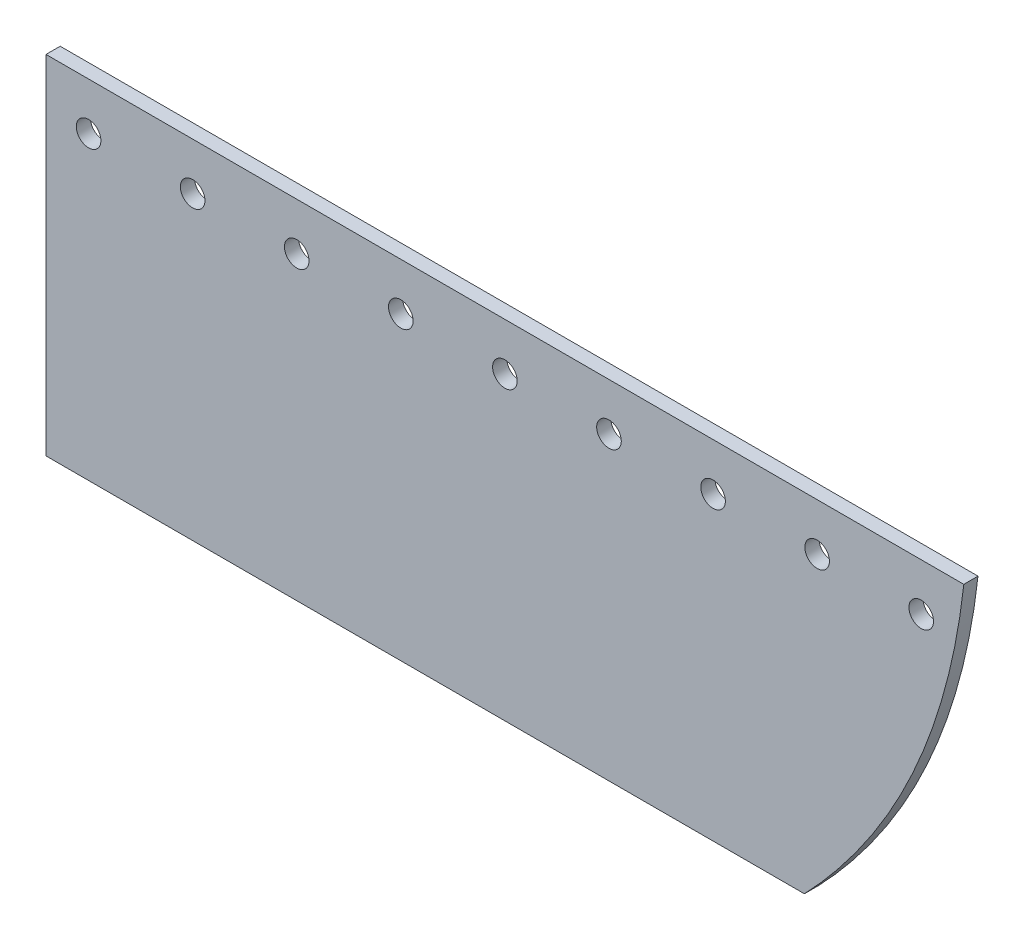
from build123d import *

# Parameters (mm, degrees)
SKETCH_1_W                 = 200
SKETCH_1_H                 = 73.5
EXTRUDE_1_DEPTH            = 3
SKETCH_2_R                 = 2.6
CUT_EXTRUDE_2_DEPTH        = 107.581248351
PATTERN_LINEAR_1_COUNT     = 5
PATTERN_LINEAR_1_PITCH     = 22
PATTERN_LINEAR_1_COL_COUNT = 5
PATTERN_LINEAR_1_COL_PITCH = 22
CUT_EXTRUDE_3_DEPTH        = 107.581248351
CUT_EXTRUDE_3_DEPTH_BACK   = 107.581248351
SKETCH_3_W                 = 3
SKETCH_3_H                 = 73.5
CUT_EXTRUDE_4_DEPTH        = 104.771684481
CUT_EXTRUDE_4_DEPTH_BACK   = 104.771684481


with BuildPart() as part:
    # 草图1 → 凸台-拉伸1 (new body)
    with BuildSketch(Plane.XY):
        Rectangle(SKETCH_1_W, SKETCH_1_H)
    extrude(amount=EXTRUDE_1_DEPTH)

    # 草图2 → 切除-拉伸2 (cut, symmetric)
    with BuildSketch(Plane.XY.offset(3)):
        with Locations((0, 26.75)):
            Circle(SKETCH_2_R)
    cut_extrude_2 = extrude(amount=CUT_EXTRUDE_2_DEPTH, both=True, mode=Mode.SUBTRACT)

    # 阵列(线性)1: 切除-拉伸2 ×5
    with Locations(*[(i * PATTERN_LINEAR_1_PITCH, 0, 0) for i in range(1, PATTERN_LINEAR_1_COUNT)]):
        add(cut_extrude_2, mode=Mode.SUBTRACT)

    # 阵列(线性)1 col: 切除-拉伸2 ×5
    with Locations(*[(-i * PATTERN_LINEAR_1_COL_PITCH, 0, 0) for i in range(1, PATTERN_LINEAR_1_COL_COUNT)]):
        add(cut_extrude_2, mode=Mode.SUBTRACT)

    # 草图3 → 切除-拉伸3 (cut, two sides: drawn at the far end of the back side and taken through both)
    with BuildSketch(Plane.XY.offset(3).offset(-CUT_EXTRUDE_3_DEPTH_BACK)):
        with Locations((-98.5, 0)):
            Rectangle(SKETCH_3_W, SKETCH_3_H)
        with Locations((98.5, 0)):
            Rectangle(SKETCH_3_W, SKETCH_3_H)
    extrude(amount=CUT_EXTRUDE_3_DEPTH + CUT_EXTRUDE_3_DEPTH_BACK, mode=Mode.SUBTRACT)

    # 草图4 → 切除-拉伸4 (cut, two sides: drawn at the far end of the back side and taken through both)
    with BuildSketch(Plane.XY.offset(3).offset(-CUT_EXTRUDE_4_DEPTH_BACK)):
        with BuildLine():
            Line((63.303207355, -36.75), (97, -36.75))
            Line((97, -36.75), (97, 36.75))
            add(Edge.make_bspline(
                [(63.303207355, -36.75), (92.189094157, -6.525878678), (97, 36.75)],
                knots=[0, 0, 0, 1, 1, 1], degree=2))
        make_face()
    extrude(amount=CUT_EXTRUDE_4_DEPTH + CUT_EXTRUDE_4_DEPTH_BACK, mode=Mode.SUBTRACT)


solid = part.part
